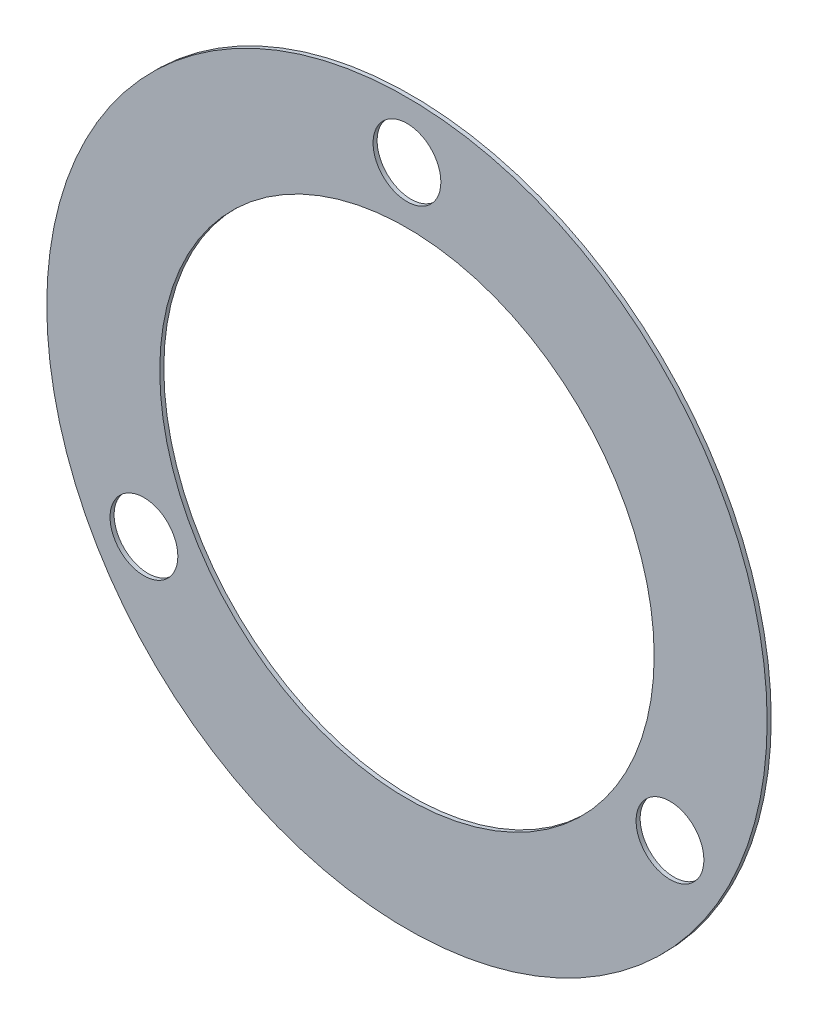
from build123d import *

# Parameters (mm, degrees)
SKETCH1_R           = 20.2438
SKETCH1_R_2         = 13.8938
SKETCH1_R_3         = 1.905
BOSS_EXTRUDE1_DEPTH = 0.2286


with BuildPart() as part:
    # Sketch1 → Boss-Extrude1 (new body)
    with BuildSketch(Plane.XY):
        Circle(SKETCH1_R)
        Circle(SKETCH1_R_2, mode=Mode.SUBTRACT)
        with Locations((0, 17.0688)):
            Circle(SKETCH1_R_3, mode=Mode.SUBTRACT)
        with Locations((14.782014412, -8.5344)):
            Circle(SKETCH1_R_3, mode=Mode.SUBTRACT)
        with Locations((-14.782014412, -8.5344)):
            Circle(SKETCH1_R_3, mode=Mode.SUBTRACT)
    extrude(amount=BOSS_EXTRUDE1_DEPTH)


solid = part.part
